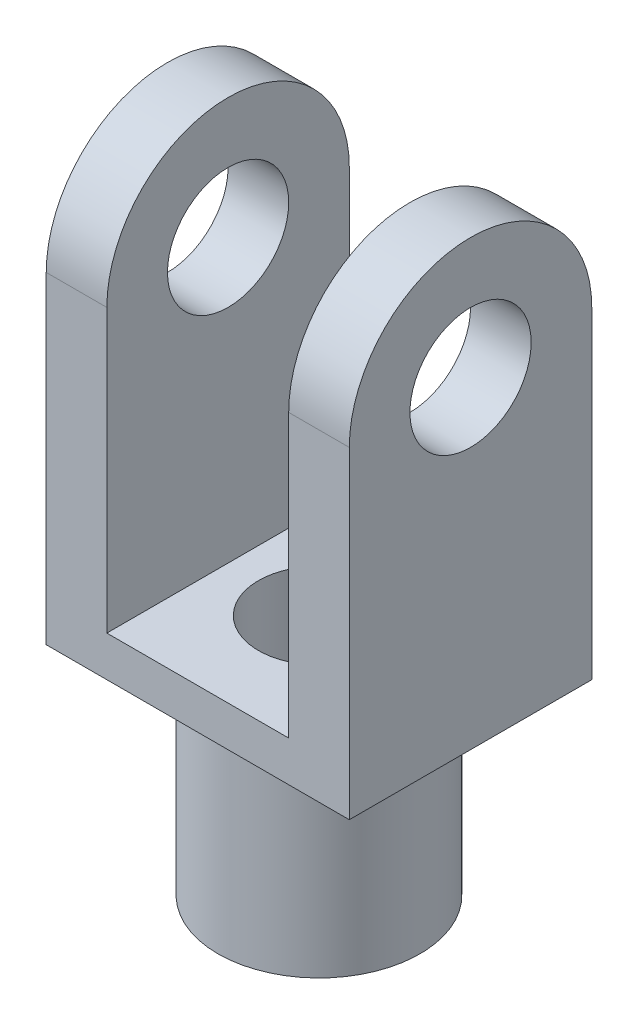
from build123d import *

# Parameters (mm, degrees)
SKETCH_1_R          = 5
EXTRUDE_1_DEPTH     = 10
SKETCH_2_W          = 15
SKETCH_2_H          = 12
EXTRUDE_2_DEPTH     = 2
SKETCH_4_R          = 3
CUT_EXTRUDE_1_DEPTH = 16.370426149
SKETCH_5_W          = 3
SKETCH_5_H          = 12
EXTRUDE_3_DEPTH     = 20
SKETCH_6_OUTSIDE_W  = 21.464
SKETCH_6_OUTSIDE_H  = 41.464
CUT_EXTRUDE_2_DEPTH = 36.846896658
SKETCH_7_R          = 3
CUT_EXTRUDE_3_DEPTH = 36.809255992


with BuildPart() as part:
    # 草图1 → 凸台-拉伸1 (new body)
    with BuildSketch(Plane(origin=(0, 0, 0), x_dir=(1, 0, 0), z_dir=(0, 1, 0))):
        with Locations(Location((0, 0, 0), (0, 0, 270))):
            Circle(SKETCH_1_R)
    extrude(amount=EXTRUDE_1_DEPTH)

    # 草图2 → 凸台-拉伸2 (add)
    with BuildSketch(Plane(origin=(0, 10, 0), x_dir=(1, 0, 0), z_dir=(0, 1, 0))):
        Rectangle(SKETCH_2_W, SKETCH_2_H)
    extrude(amount=EXTRUDE_2_DEPTH)

    # 草图4 → 切除-拉伸1 (cut, through all)
    with BuildSketch(Plane(origin=(0, 0, 0), x_dir=(-1, 0, 0), z_dir=(0, -1, 0))):
        with Locations(Location((0, 0, 0), (0, 0, 90))):
            Circle(SKETCH_4_R)
    extrude(amount=-CUT_EXTRUDE_1_DEPTH, mode=Mode.SUBTRACT)

    # 草图5 → 凸台-拉伸3 (add)
    with BuildSketch(Plane(origin=(0, 12, 0), x_dir=(1, 0, 0), z_dir=(0, 1, 0))):
        with Locations((-6, 0)):
            Rectangle(SKETCH_5_W, SKETCH_5_H)
        with Locations((6, 0)):
            Rectangle(SKETCH_5_W, SKETCH_5_H)
    extrude(amount=EXTRUDE_3_DEPTH)

    # 草图6 outside → 切除-拉伸2 (cut, through all)
    with BuildSketch(Plane.ZY.offset(7.5)):
        with Locations((0, 16)):
            Rectangle(SKETCH_6_OUTSIDE_W, SKETCH_6_OUTSIDE_H)
        with BuildLine():
            Line((-6, -1.626301301), (-6, 25.957828691))
            ThreePointArc((-6, 25.957828691), (0, 31.957828691), (6, 25.957828691))
            Line((6, 25.957828691), (6, -1.626301301))
            ThreePointArc((6, -1.626301301), (0, -7.626301301), (-6, -1.626301301))
        make_face(mode=Mode.SUBTRACT)
    extrude(amount=-CUT_EXTRUDE_2_DEPTH, mode=Mode.SUBTRACT)

    # 草图7 → 切除-拉伸3 (cut, through all)
    with BuildSketch(Plane(origin=(7.5, 0, 0), x_dir=(0, 0, -1), z_dir=(1, 0, 0))):
        with Locations((0, 25.957828691)):
            Circle(SKETCH_7_R)
    extrude(amount=-CUT_EXTRUDE_3_DEPTH, mode=Mode.SUBTRACT)


solid = part.part
